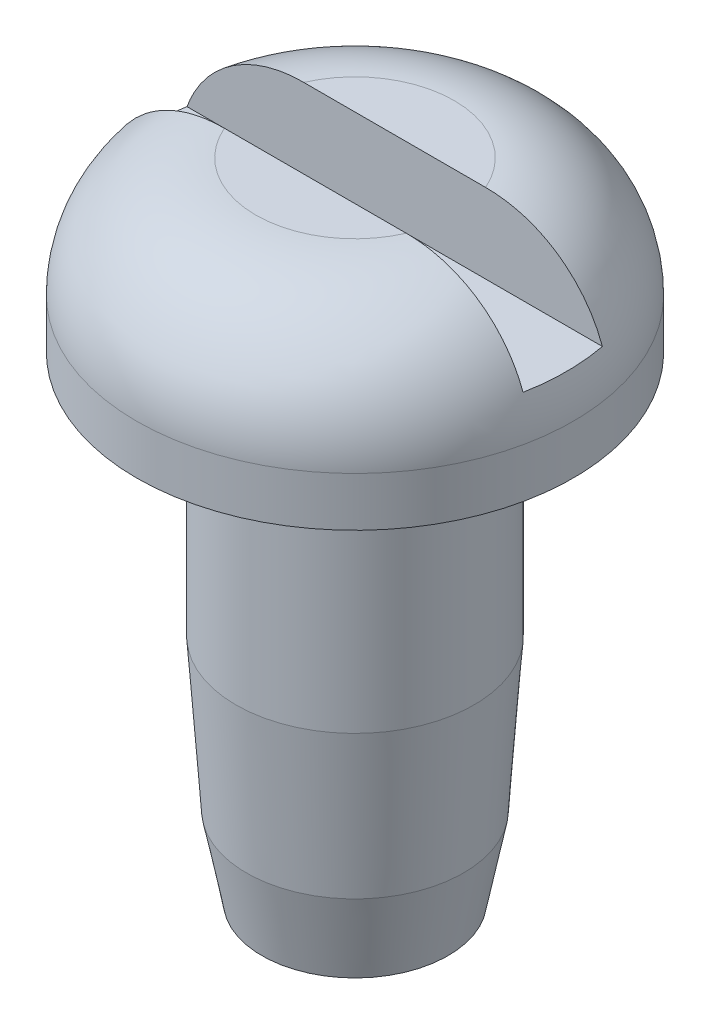
from build123d import *

# Parameters (mm, degrees)
SKETCH_2_W          = 1
SKETCH_2_H          = 1
CUT_EXTRUDE_1_DEPTH = 5


with BuildPart() as part:
    # Эскиз1 → Повернуть1 (revolve)
    with BuildSketch(Plane.XY, mode=Mode.PRIVATE) as revolve_1_sk:
        with BuildLine():
            Line((0, 0), (0, 8.12))
            Line((0, 8.12), (1.25, 8.12))
            ThreePointArc((1.25, 8.12), (2.310660172, 7.680660172), (2.75, 6.62))
            Line((2.75, 6.62), (2.75, 6))
            Line((2.75, 6), (1.5, 6))
            Line((1.5, 6), (1.5, 2.9))
            Line((1.5, 2.9), (1.367139057, 1))
            Line((1.367139057, 1), (1.172758748, 0))
            Line((1.172758748, 0), (0, 0))
        make_face()
    revolve(revolve_1_sk.sketch.rotate(Axis((0, 0, 0), (0, 1, 0)), 90), axis=Axis((0, 0, 0), (0, 1, 0)))

    # Эскиз2 → Вырез-Вытянуть1 (cut, symmetric)
    with BuildSketch(Plane(origin=(0, 0, 0), x_dir=(0, 0, -1), z_dir=(1, 0, 0))):
        with Locations((0, 7.62)):
            Rectangle(SKETCH_2_W, SKETCH_2_H)
    extrude(amount=CUT_EXTRUDE_1_DEPTH, both=True, mode=Mode.SUBTRACT)


solid = part.part
